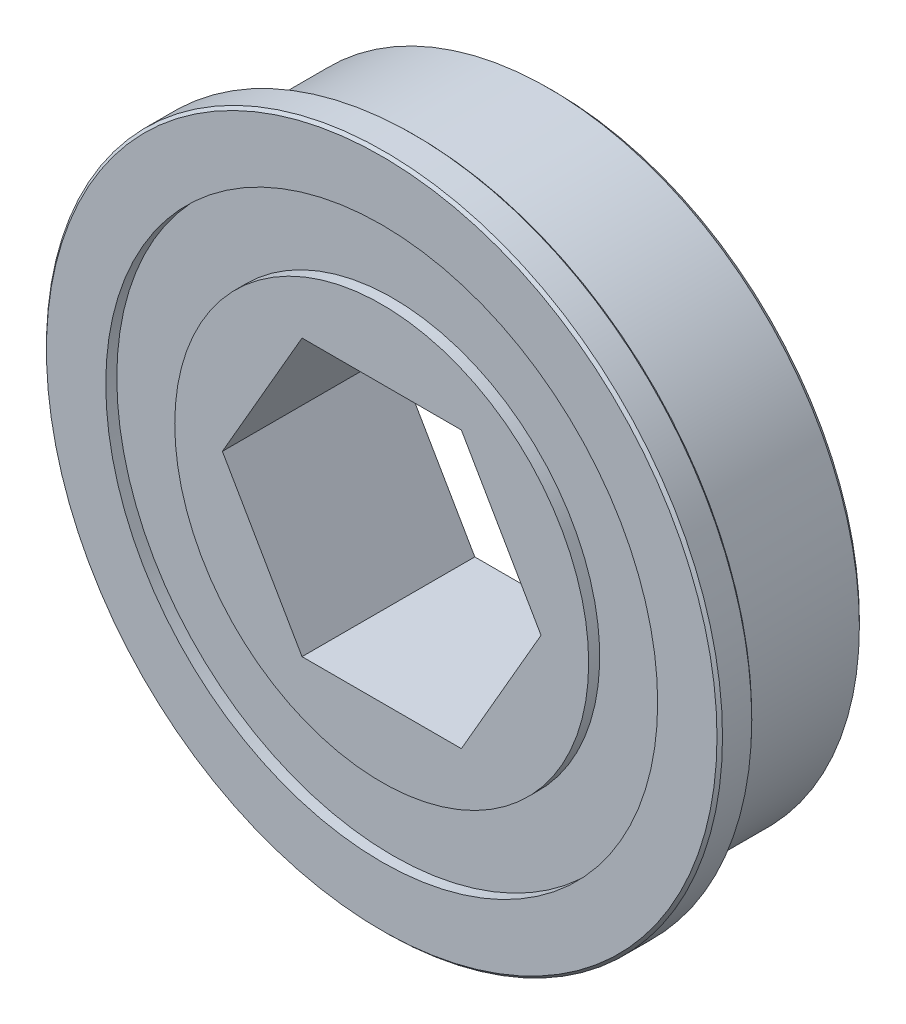
from build123d import *

# Parameters (mm, degrees)
F_1_1_DIAMETER_HOLE1_D     = 25.4
F_1_1_DIAMETER_HOLE1_DEPTH = 0.508
SKETCH4_R                  = 9.525
BOSS_EXTRUDE1_DEPTH        = 0.508
F_1_1_DIAMETER_HOLE2_D     = 25.4
F_1_1_DIAMETER_HOLE2_DEPTH = 0.508
BOSS_EXTRUDE2_START        = 0.508
SKETCH7_R                  = 9.525
BOSS_EXTRUDE2_DEPTH        = 0.508
CUT_EXTRUDE1_DEPTH         = 24.393890495
CHAMFER1_SIZE              = 0.127
CHAMFER2_SIZE              = 0.254


with BuildPart() as part:
    # Sketch1 → Revolve1 (revolve)
    with BuildSketch(Plane(origin=(0, 0, 0), x_dir=(1, 0, 0), z_dir=(0, 1, 0))):
        Polygon((14.2875, 3.975), (0, 3.975), (0, -3.975), (15.5575, -3.975), (15.5575, -2.375), (14.1605, -2.375), (14.1605, -2.121), (14.2875, -2.121), align=None)
    revolve(axis=Axis((0, 0, -3.975), (0, 0, 1)))

    # 1 (1) Diameter Hole1
    with Locations(Plane(origin=(0, 0, -3.975), x_dir=(-1, 0, 0), z_dir=(0, 0, -1))):
        with Locations((0, 0)):
            Hole(F_1_1_DIAMETER_HOLE1_D / 2, depth=F_1_1_DIAMETER_HOLE1_DEPTH)

    # Sketch4 → Boss-Extrude1 (add)
    with BuildSketch(Plane(origin=(0, 0, -3.467), x_dir=(-1, 0, 0), z_dir=(0, 0, -1))):
        with Locations(Location((0, 0, 0), (0, 0, 180))):
            Circle(SKETCH4_R)
    extrude(amount=BOSS_EXTRUDE1_DEPTH)

    # 1 (1) Diameter Hole2
    with Locations(Plane.XY.offset(3.975)):
        with Locations((0, 0)):
            Hole(F_1_1_DIAMETER_HOLE2_D / 2, depth=F_1_1_DIAMETER_HOLE2_DEPTH)

    # Sketch7 → Boss-Extrude2 (add)
    with BuildSketch(Plane.XY.offset(3.467).offset(BOSS_EXTRUDE2_START)):
        Circle(SKETCH7_R)
    extrude(amount=-BOSS_EXTRUDE2_DEPTH)

    # Sketch8 → Cut-Extrude1 (cut, through all)
    with BuildSketch(Plane.XY.offset(3.975)):
        Polygon((3.666174209, 6.35), (-3.666174209, 6.35), (-7.332348419, 0), (-3.666174209, -6.35), (3.666174209, -6.35), (7.332348419, 0), align=None)
    extrude(amount=-CUT_EXTRUDE1_DEPTH, mode=Mode.SUBTRACT)

    # Chamfer1
    chamfer1_edges = [part.edges().sort_by_distance(p)[0] for p in [
        (-15.5575, 0, 2.375),
        (-15.5575, 0, 3.975),
    ]]
    chamfer(chamfer1_edges, length=CHAMFER1_SIZE)

    # Chamfer2
    chamfer2_edges = [part.edges().sort_by_distance(p)[0] for p in [
        (-14.2875, 0, -3.975),
    ]]
    chamfer(chamfer2_edges, length=CHAMFER2_SIZE)


solid = part.part
